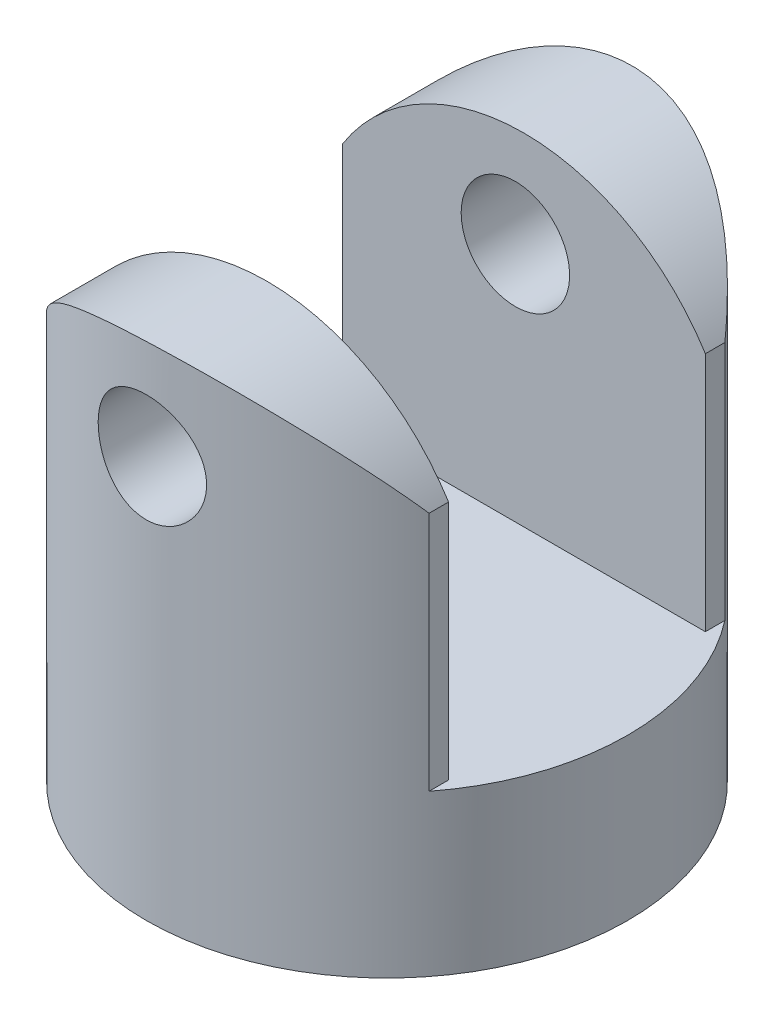
from build123d import *

# Parameters (mm, degrees)
SKETCH1_R                            = 15
BOSS_EXTRUDE1_DEPTH                  = 10
BOSS_EXTRUDE2_REACH                  = 25.452
BOSS_EXTRUDE2_END_RADIUS             = 15
BOSS_EXTRUDE2_DIRECTION_2_REACH      = 25.452
BOSS_EXTRUDE2_DIRECTION_2_END_RADIUS = 15
SKETCH3_W                            = 16
SKETCH3_H                            = 50
CUT_EXTRUDE1_DEPTH                   = 44.842776862
CUT_EXTRUDE2_DEPTH                   = 42.60493807
CUT_EXTRUDE2_DEPTH_BACK              = 42.60493807
SKETCH4_R                            = 3.3782


with BuildPart() as part:
    # Sketch1 → Boss-Extrude1 (new body)
    with BuildSketch(Plane(origin=(0, 0, 0), x_dir=(1, 0, 0), z_dir=(0, 1, 0))):
        with Locations(Location((0, 0, 0), (0, 0, 270))):
            Circle(SKETCH1_R)
    extrude(amount=BOSS_EXTRUDE1_DEPTH)

    # Boss-Extrude2: up to this cylinder (the profile starts inside it)
    boss_extrude2_end = Plane(origin=(0, 19.788333, 0), z_dir=(0, -1, 0)) * Cylinder(BOSS_EXTRUDE2_END_RADIUS, 81.904, mode=Mode.PRIVATE)
    # Sketch2 → Boss-Extrude2 (add, up to the surface)
    with BuildSketch(Plane.XY, mode=Mode.PRIVATE) as boss_extrude2_sk1:
        with BuildLine():
            Line((-10.780802974, 10), (11.836881633, 10))
            Line((11.836881633, 10), (11.836881633, 25))
            ThreePointArc((11.836881633, 25), (0.528039329, 31.256533044), (-10.780802974, 25))
            Line((-10.780802974, 25), (-10.780802974, 10))
        make_face()
    boss_extrude2_tool1 = extrude(boss_extrude2_sk1.sketch, amount=BOSS_EXTRUDE2_REACH, mode=Mode.PRIVATE) & boss_extrude2_end
    add(boss_extrude2_tool1.solids().sort_by_distance((0.528039, 19.788333, 0))[0])

    # Boss-Extrude2 direction 2: up to this cylinder (the profile starts inside it)
    boss_extrude2_direction_2_end = Plane(origin=(0, 19.788333, 0), z_dir=(0, -1, 0)) * Cylinder(BOSS_EXTRUDE2_DIRECTION_2_END_RADIUS, 81.904, mode=Mode.PRIVATE)
    # Sketch2 → Boss-Extrude2 direction 2 (add, up to the surface)
    with BuildSketch(Plane.XY, mode=Mode.PRIVATE) as boss_extrude2_direction_2_sk1:
        with BuildLine():
            Line((-10.780802974, 10), (11.836881633, 10))
            Line((11.836881633, 10), (11.836881633, 25))
            ThreePointArc((11.836881633, 25), (0.528039329, 31.256533044), (-10.780802974, 25))
            Line((-10.780802974, 25), (-10.780802974, 10))
        make_face()
    boss_extrude2_direction_2_tool1 = extrude(boss_extrude2_direction_2_sk1.sketch, amount=-BOSS_EXTRUDE2_DIRECTION_2_REACH, mode=Mode.PRIVATE) & boss_extrude2_direction_2_end
    add(boss_extrude2_direction_2_tool1.solids().sort_by_distance((0.528039, 19.788333, 0))[0])

    # Sketch3 → Cut-Extrude1 (cut, through all)
    with BuildSketch(Plane(origin=(11.836881633, 0, 0), x_dir=(0, 0, -1), z_dir=(1, 0, 0))):
        with Locations((0, 35)):
            Rectangle(SKETCH3_W, SKETCH3_H)
    extrude(amount=-CUT_EXTRUDE1_DEPTH, mode=Mode.SUBTRACT)

    # Sketch4 → Cut-Extrude2 (cut, two sides: drawn at the far end of the back side and taken through both)
    with BuildSketch(Plane(origin=(0, 0, 8), x_dir=(-1, 0, 0), z_dir=(0, 0, -1)).offset(-CUT_EXTRUDE2_DEPTH_BACK)):
        with Locations((0, 25)):
            Circle(SKETCH4_R)
    extrude(amount=CUT_EXTRUDE2_DEPTH + CUT_EXTRUDE2_DEPTH_BACK, mode=Mode.SUBTRACT)


solid = part.part
